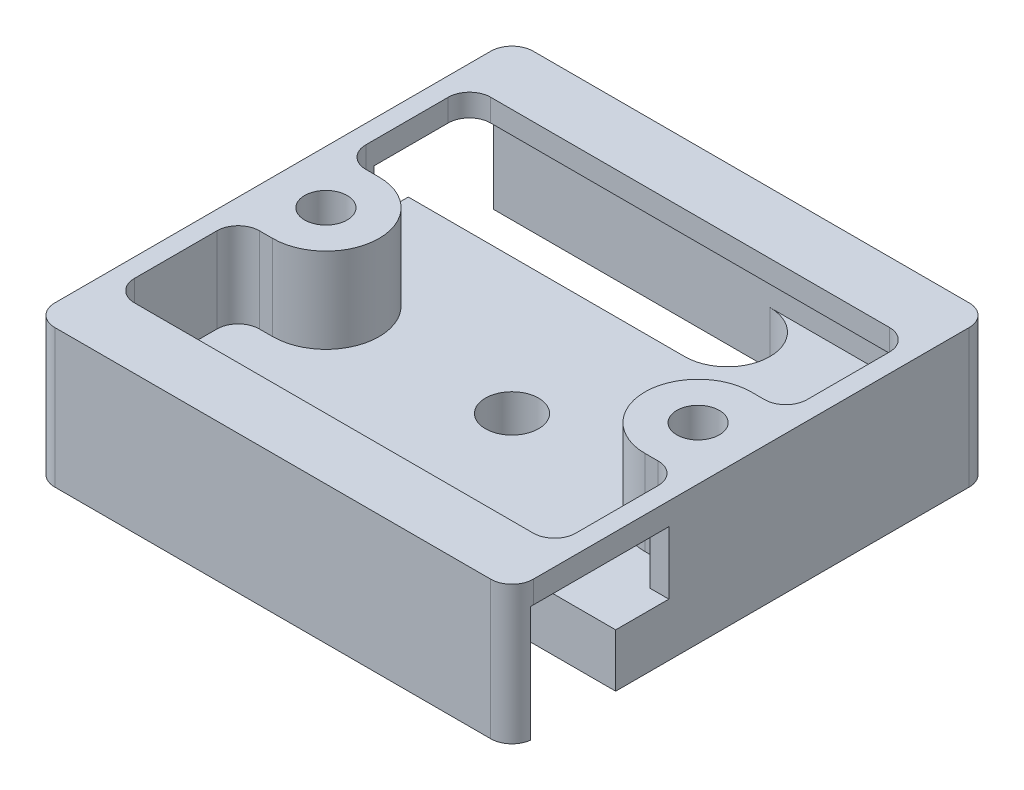
from build123d import *

# Parameters (mm, degrees)
CROQUIS1_R                   = 2.5
SALIENTE_EXTRUIR1_DEPTH      = 5
SALIENTE_EXTRUIR2_DEPTH      = 6
SALIENTE_EXTRUIR5_DEPTH      = 2
SALIENTE_EXTRUIR5_DEPTH_BACK = 0.1
CROQUIS2_W                   = 41.5
CROQUIS2_H                   = 5.75
CROQUIS2_H_2                 = 4
CROQUIS2_H_3                 = 1.75
CROQUIS2_W_2                 = 1.75
CROQUIS3_R                   = 2
SALIENTE_EXTRUIR6_DEPTH      = 8
CORTAR_EXTRUIR1_REACH        = 36.373
CORTAR_EXTRUIR2_START        = -2
CROQUIS4_R                   = 3.000239327
CROQUIS4_R_2                 = 2
CROQUIS4_R_3                 = 3
CORTAR_EXTRUIR2_DEPTH        = 2
REDONDEO1_R                  = 2
REDONDEO2_R                  = 2


with BuildPart() as part:
    # Croquis1 → Saliente-Extruir1 (new body)
    with BuildSketch(Plane(origin=(0, 0, 0), x_dir=(1, 0, 0), z_dir=(0, 1, 0))):
        with BuildLine():
            Line((-22.5, -22.5), (22.5, -22.5))
            Line((22.5, -22.5), (22.5, -20.75))
            Line((22.5, -20.75), (-3.5, -20.75))
            ThreePointArc((-3.5, -20.75), (-7.5, -16.75), (-3.5, -12.75))
            Line((-3.5, -12.75), (22.5, -12.75))
            Line((22.5, -12.75), (22.5, 22.5))
            Line((22.5, 22.5), (-22.5, 22.5))
            Line((-22.5, 22.5), (-22.5, 20.75))
            Line((-22.5, 20.75), (3.5, 20.75))
            ThreePointArc((3.5, 20.75), (7.5, 16.75), (3.5, 12.75))
            Line((3.5, 12.75), (-22.5, 12.75))
            Line((-22.5, 12.75), (-22.5, -22.5))
        make_face()
        with Locations(Location((0, 0, 0), (0, 0, 270))):
            Circle(CROQUIS1_R, mode=Mode.SUBTRACT)
    extrude(amount=-SALIENTE_EXTRUIR1_DEPTH)

    # Croquis1<3> → Saliente-Extruir2 (add)
    with BuildSketch(Plane(origin=(0, 0, 0), x_dir=(1, 0, 0), z_dir=(0, 1, 0))):
        Polygon((-22.5, 7.75), (-22.5, -22.5), (22.5, -22.5), (22.5, -20.75), (-3.5, -20.75), (-20.75, -20.75), (-20.75, 7.75), align=None)
        Polygon((-22.5, 22.5), (-22.5, 20.75), (3.5, 20.75), (20.75, 20.75), (20.75, -7.75), (22.5, -7.75), (22.5, 22.5), align=None)
    extrude(amount=SALIENTE_EXTRUIR2_DEPTH)

    # Croquis2 → Saliente-Extruir5 (add, two sides: drawn at the far end of the back side and taken through both)
    with BuildSketch(Plane(origin=(0, 6, 0), x_dir=(1, 0, 0), z_dir=(0, 1, 0)).offset(-SALIENTE_EXTRUIR5_DEPTH_BACK)):
        with Locations((0, 19.625)):
            Rectangle(CROQUIS2_W, CROQUIS2_H)
        Polygon((-20.75, 22.5), (-22.5, 22.5), (-22.5, 7.75), (-20.75, 7.75), (-20.75, 16.75), align=None)
        with Locations((0, -18.75)):
            Rectangle(CROQUIS2_W, CROQUIS2_H_2)
        with Locations((0, -21.625)):
            Rectangle(CROQUIS2_W, CROQUIS2_H_3)
        Polygon((-20.75, 7.75), (-22.5, 7.75), (-22.5, -22.5), (-20.75, -22.5), (-20.75, -20.75), (-20.75, -16.75), align=None)
        Polygon((22.5, 22.5), (20.75, 22.5), (20.75, 16.75), (20.75, -16.75), (20.75, -20.75), (22.5, -20.75), align=None)
        with Locations((21.625, -21.625)):
            Rectangle(CROQUIS2_W_2, CROQUIS2_H_3)
    extrude(amount=SALIENTE_EXTRUIR5_DEPTH + SALIENTE_EXTRUIR5_DEPTH_BACK)

    # Croquis3 → Saliente-Extruir6 (add)
    with BuildSketch(Plane(origin=(0, 8, 0), x_dir=(1, 0, 0), z_dir=(0, 1, 0))):
        with BuildLine():
            Line((-20.75, 5), (-20.75, -5))
            Line((-20.75, -5), (-17.5, -5))
            Line((-17.5, -5), (-17.5, -2))
            ThreePointArc((-17.5, -2), (-19.5, 0), (-17.5, 2))
            Line((-17.5, 2), (-17.5, 5))
            Line((-17.5, 5), (-20.75, 5))
        make_face()
        with Locations((-17.5, 0)):
            Circle(CROQUIS3_R)
        with BuildLine():
            Line((-17.5, -5), (-17.5, 5))
            ThreePointArc((-17.5, 5), (-12.5, 0), (-17.5, -5))
        make_face()
        with BuildLine():
            ThreePointArc((-17.5, 2), (-19.5, 0), (-17.5, -2))
            Line((-17.5, -2), (-17.5, 2))
        make_face()
        with BuildLine():
            Line((-17.5, 2), (-17.5, -2))
            ThreePointArc((-17.5, -2), (-16.085786438, -1.414213562), (-15.5, 0))
            ThreePointArc((-15.5, 0), (-16.085786438, 1.414213562), (-17.5, 2))
        make_face()
    saliente_extruir6 = extrude(amount=-SALIENTE_EXTRUIR6_DEPTH)

    # Croquis3<3> → Cortar-Extruir1 (cut, up to next)
    with BuildSketch(Plane(origin=(0, 8, 0), x_dir=(1, 0, 0), z_dir=(0, 1, 0)), mode=Mode.PRIVATE) as cortar_extruir1_sk1:
        with BuildLine():
            ThreePointArc((-17.5, 2), (-19.5, 0), (-17.5, -2))
            Line((-17.5, -2), (-17.5, 2))
        make_face()
    cortar_extruir1_tool1 = extrude(cortar_extruir1_sk1.sketch, amount=-CORTAR_EXTRUIR1_REACH, mode=Mode.PRIVATE) & part.part
    # Croquis3<3> → Cortar-Extruir1 (cut, up to next)
    with BuildSketch(Plane(origin=(0, 8, 0), x_dir=(1, 0, 0), z_dir=(0, 1, 0)), mode=Mode.PRIVATE) as cortar_extruir1_sk2:
        with BuildLine():
            Line((-17.5, 2), (-17.5, -2))
            ThreePointArc((-17.5, -2), (-16.085786438, -1.414213562), (-15.5, 0))
            ThreePointArc((-15.5, 0), (-16.085786438, 1.414213562), (-17.5, 2))
        make_face()
    cortar_extruir1_tool2 = extrude(cortar_extruir1_sk2.sketch, amount=-CORTAR_EXTRUIR1_REACH, mode=Mode.PRIVATE) & part.part
    # Croquis3<3> → Cortar-Extruir1 (cut, up to next)
    with BuildSketch(Plane(origin=(0, 8, 0), x_dir=(1, 0, 0), z_dir=(0, 1, 0)), mode=Mode.PRIVATE) as cortar_extruir1_sk3:
        with BuildLine():
            ThreePointArc((-17.5, 2), (-19.5, 0), (-17.5, -2))
            Line((-17.5, -2), (-17.5, 2))
        make_face()
    cortar_extruir1_tool3 = extrude(cortar_extruir1_sk3.sketch, amount=-CORTAR_EXTRUIR1_REACH, mode=Mode.PRIVATE) & part.part
    # Croquis3<3> → Cortar-Extruir1 (cut, up to next)
    with BuildSketch(Plane(origin=(0, 8, 0), x_dir=(1, 0, 0), z_dir=(0, 1, 0)), mode=Mode.PRIVATE) as cortar_extruir1_sk4:
        with BuildLine():
            Line((-17.5, 2), (-17.5, -2))
            ThreePointArc((-17.5, -2), (-16.085786438, -1.414213562), (-15.5, 0))
            ThreePointArc((-15.5, 0), (-16.085786438, 1.414213562), (-17.5, 2))
        make_face()
    cortar_extruir1_tool4 = extrude(cortar_extruir1_sk4.sketch, amount=-CORTAR_EXTRUIR1_REACH, mode=Mode.PRIVATE) & part.part
    cortar_extruir1_1 = cortar_extruir1_tool1.solids().sort_by_distance((-18.348826, 8, 0))[0]
    add(cortar_extruir1_1, mode=Mode.SUBTRACT)
    cortar_extruir1_2 = cortar_extruir1_tool2.solids().sort_by_distance((-16.651174, 8, 0))[0]
    add(cortar_extruir1_2, mode=Mode.SUBTRACT)
    cortar_extruir1_3 = cortar_extruir1_tool3.solids().sort_by_distance((-18.348826, 8, 0))[0]
    add(cortar_extruir1_3, mode=Mode.SUBTRACT)
    cortar_extruir1_4 = cortar_extruir1_tool4.solids().sort_by_distance((-16.651174, 8, 0))[0]
    add(cortar_extruir1_4, mode=Mode.SUBTRACT)
    cortar_extruir1 = cortar_extruir1_1 + cortar_extruir1_2 + cortar_extruir1_3 + cortar_extruir1_4  # Cortar-Extruir1 as one shape, for the pattern or mirror that repeats it

    # Simetría1: Saliente-Extruir6, Cortar-Extruir1 across plane
    add(saliente_extruir6.mirror(Plane(origin=(0, 0, 0), x_dir=(0, 0, 1), z_dir=(1, 0, 0))))
    add(cortar_extruir1.mirror(Plane(origin=(0, 0, 0), x_dir=(0, 0, 1), z_dir=(1, 0, 0))), mode=Mode.SUBTRACT)

    # Croquis4 → Cortar-Extruir2 (cut)
    # profile 1 of 2: a face of its own
    with BuildSketch(Plane.XZ.offset(5).offset(CORTAR_EXTRUIR2_START)):
        with Locations(Location((-17.5, 0, 0), (0, 0, 270))):
            Circle(CROQUIS4_R)
        with Locations(Location((-17.5, 0, 0), (0, 0, 90))):
            Circle(CROQUIS4_R_2, mode=Mode.SUBTRACT)
    # profile 2 of 2: a face of its own
    with BuildSketch(Plane.XZ.offset(5).offset(CORTAR_EXTRUIR2_START)):
        with Locations(Location((17.5, 0, 0), (0, 0, 270))):
            Circle(CROQUIS4_R_3)
        with Locations(Location((17.5, 0, 0), (0, 0, 90))):
            Circle(CROQUIS4_R_2, mode=Mode.SUBTRACT)
    extrude(amount=CORTAR_EXTRUIR2_DEPTH, mode=Mode.SUBTRACT)

    # Redondeo1
    redondeo1_edges = [part.edges().sort_by_distance(p)[0] for p in [
        (20.75, 6.95, 16.75),
        (-20.75, 6.95, 16.75),
        (20.75, 6.95, -16.75),
        (-20.75, 4, -5),
        (-20.75, 4, 5),
        (20.75, 4, 5),
        (20.75, 4, -5),
        (-20.75, 6.95, -16.75),
    ]]
    fillet(redondeo1_edges, radius=REDONDEO1_R)

    # Redondeo2
    redondeo2_edges = [part.edges().sort_by_distance(p)[0] for p in [
        (-22.5, 1.5, -22.5),
        (22.5, 1.5, -22.5),
        (-22.5, 1.5, 22.5),
        (22.5, 1.5, 22.5),
        (20.75, 2.95, -20.75),
        (-20.75, 2.95, 20.75),
    ]]
    fillet(redondeo2_edges, radius=REDONDEO2_R)


solid = part.part
